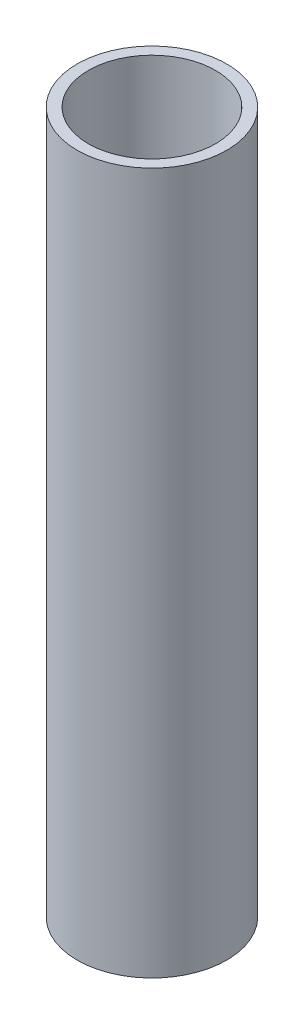
from build123d import *

# Parameters (mm, degrees)
SKETCH_1_R      = 16
SKETCH_1_R_2    = 13.6
EXTRUDE_1_DEPTH = 150


with BuildPart() as part:
    # 草图1 → 凸台-拉伸1 (new body)
    with BuildSketch(Plane(origin=(0, 0, 0), x_dir=(1, 0, 0), z_dir=(0, 1, 0))):
        with Locations(Location((0, 0, 0), (0, 0, 270))):
            Circle(SKETCH_1_R)
        with Locations(Location((0, 0, 0), (0, 0, 270))):
            Circle(SKETCH_1_R_2, mode=Mode.SUBTRACT)
    extrude(amount=EXTRUDE_1_DEPTH)


solid = part.part
